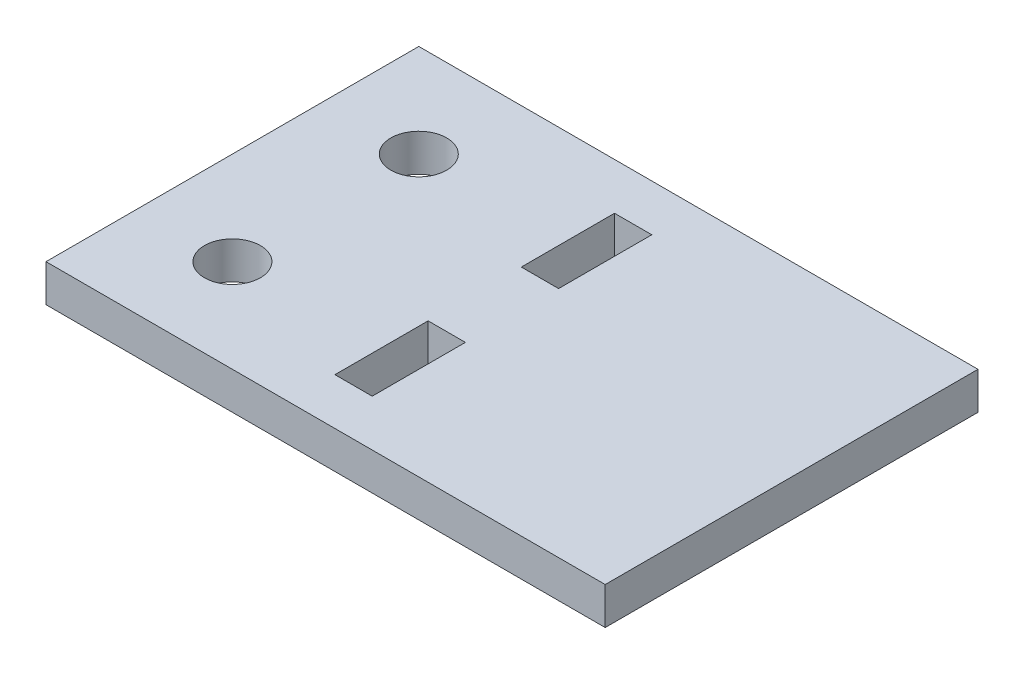
from build123d import *

# Parameters (mm, degrees)
SKETCH1_W           = 30
SKETCH1_H           = 20
SKETCH1_W_2         = 2
SKETCH1_H_2         = 5
BOSS_EXTRUDE1_DEPTH = 2
SKETCH2_R           = 1.5
CUT_EXTRUDE1_DEPTH  = 10


with BuildPart() as part:
    # Sketch1 → Boss-Extrude1 (new body)
    with BuildSketch(Plane(origin=(0, 0, 0), x_dir=(1, 0, 0), z_dir=(0, 1, 0))):
        Rectangle(SKETCH1_W, SKETCH1_H)
        with Locations((-1, 5)):
            Rectangle(SKETCH1_W_2, SKETCH1_H_2, mode=Mode.SUBTRACT)
        with Locations((-1, -5)):
            Rectangle(SKETCH1_W_2, SKETCH1_H_2, mode=Mode.SUBTRACT)
    extrude(amount=BOSS_EXTRUDE1_DEPTH)

    # Sketch2 → Cut-Extrude1 (cut)
    with BuildSketch(Plane(origin=(0, 2, 0), x_dir=(1, 0, 0), z_dir=(0, 1, 0))):
        with Locations(Location((-10, 5, 0), (0, 0, 270))):
            Circle(SKETCH2_R)
        with Locations(Location((-10, -5, 0), (0, 0, 270))):
            Circle(SKETCH2_R)
    extrude(amount=-CUT_EXTRUDE1_DEPTH, mode=Mode.SUBTRACT)


solid = part.part
